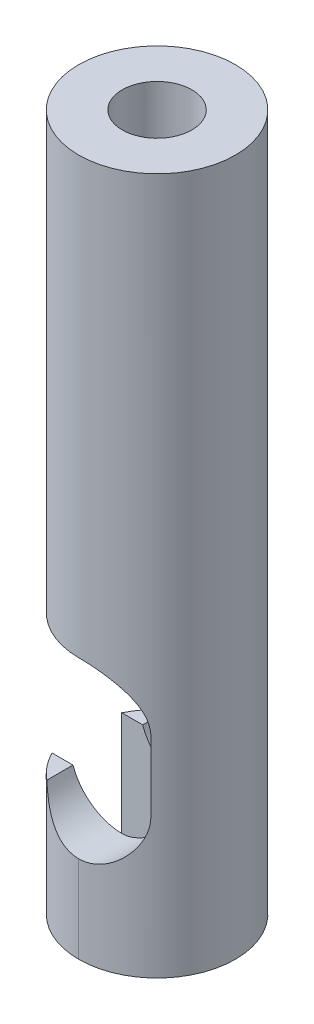
from build123d import *

# Parameters (mm, degrees)
SKETCH1_R               = 5.715
SKETCH1_R_2             = 2.54
BOSS_EXTRUDE1_DEPTH     = 50.8
CUT_EXTRUDE1_DEPTH      = 52.438919604
CUT_EXTRUDE1_DEPTH_BACK = 52.438919604
CUT_EXTRUDE2_DEPTH      = 50.8


with BuildPart() as part:
    # Sketch1 → Boss-Extrude1 (new body)
    with BuildSketch(Plane(origin=(0, 0, 0), x_dir=(1, 0, 0), z_dir=(0, 1, 0))):
        with Locations(Location((0, 0, 0), (0, 0, 270))):
            Circle(SKETCH1_R)
        with Locations(Location((0, 0, 0), (0, 0, 270))):
            Circle(SKETCH1_R_2, mode=Mode.SUBTRACT)
    extrude(amount=BOSS_EXTRUDE1_DEPTH)

    # Sketch3 → Cut-Extrude1 (cut, two sides: drawn at the far end of the back side and taken through both)
    with BuildSketch(Plane.XY.offset(-CUT_EXTRUDE1_DEPTH_BACK)):
        with BuildLine():
            Line((3.81, 15.24), (3.81, 10.16))
            ThreePointArc((3.81, 10.16), (0, 6.35), (-3.81, 10.16))
            Line((-3.81, 10.16), (-3.81, 15.24))
            ThreePointArc((-3.81, 15.24), (0, 19.05), (3.81, 15.24))
        make_face()
    extrude(amount=CUT_EXTRUDE1_DEPTH + CUT_EXTRUDE1_DEPTH_BACK, mode=Mode.SUBTRACT)

    # Sketch4 → Cut-Extrude2 (cut)
    with BuildSketch(Plane(origin=(0, 0, 0), x_dir=(0, 0, -1), z_dir=(1, 0, 0))):
        Polygon((5.715, 19.05), (-5.715, 19.05), (-5.715, 8.89), (-2.54, 8.89), (-2.54, 0), (2.54, 0), (2.54, 8.89), (5.715, 8.89), align=None)
    extrude(amount=-CUT_EXTRUDE2_DEPTH, mode=Mode.SUBTRACT)


solid = part.part
